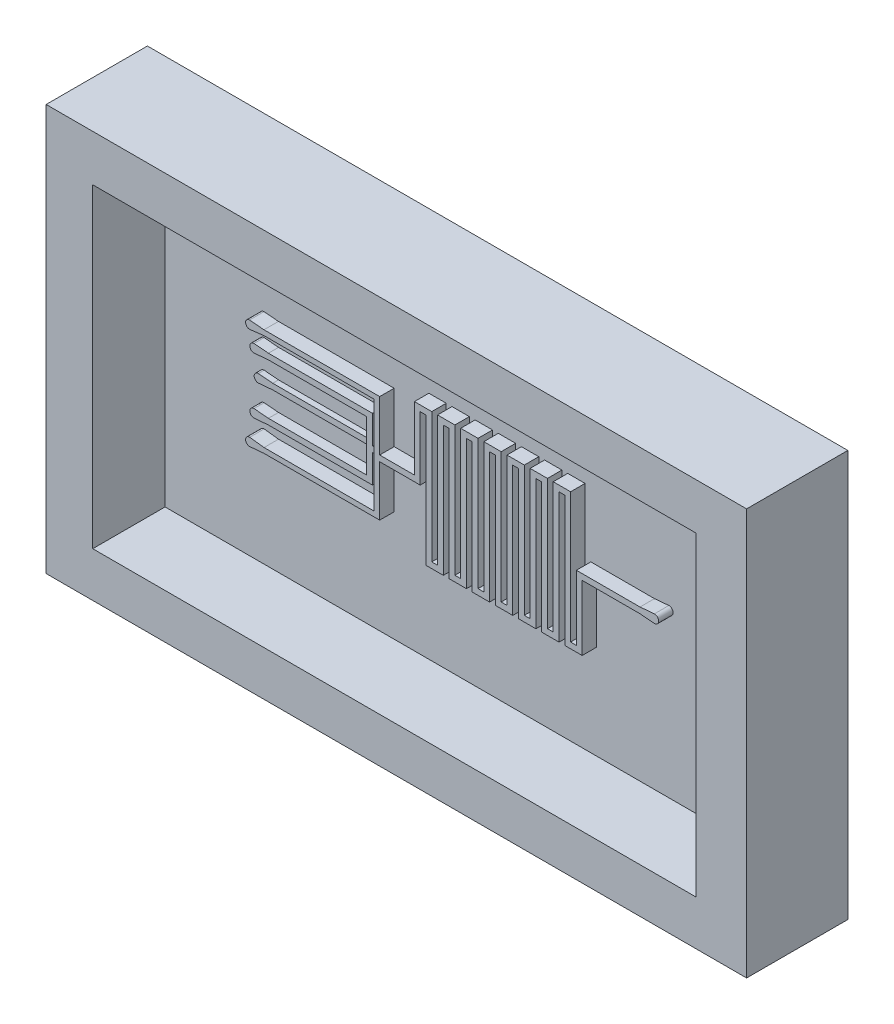
from build123d import *

# Parameters (mm, degrees)
BOSS_EXTRUDE1_DEPTH = 0.2
BOSS_EXTRUDE2_DEPTH = 0.35
BOSS_EXTRUDE3_DEPTH = 0.5
SKETCH2_W           = 20.858957108
SKETCH2_H           = 10.895771928
BOSS_EXTRUDE4_DEPTH = 1
SKETCH3_W           = 24.214928457
SKETCH3_H           = 14.045107393
SKETCH3_W_2         = 20.858957108
SKETCH3_H_2         = 10.895771928
BOSS_EXTRUDE5_DEPTH = 3.5


with BuildPart() as part:
    # Sketch1 → Boss-Extrude1 (new body)
    with BuildSketch(Plane.XY):
        with BuildLine():
            Line((-3.397107478, 0.09272626), (0.002892522, 0.09272626))
            Line((0.002892522, 0.09272626), (0.002892522, -0.10727374))
            Line((0.002892522, -0.10727374), (-3.397107478, -0.10727374))
            Line((-3.397107478, -0.10727374), (-3.895204827, -0.150851611))
            ThreePointArc((-3.895204827, -0.150851611), (-4.038782699, -0.00727374), (-3.895204827, 0.136304132))
            Line((-3.895204827, 0.136304132), (-3.397107478, 0.09272626))
        make_face()
    extrude(amount=BOSS_EXTRUDE1_DEPTH)

    # Sketch1<4> → Boss-Extrude2 (add)
    with BuildSketch(Plane.XY):
        with BuildLine():
            Line((0.402892522, -0.10727374), (0.402892522, 0.09272626))
            Line((0.402892522, 0.09272626), (0.202892522, 0.09272626))
            Line((0.202892522, 0.09272626), (0.202892522, 1.067220881))
            Line((0.202892522, 1.067220881), (-3.397107478, 1.067220881))
            Line((-3.397107478, 1.067220881), (-3.895204827, 1.110798752))
            ThreePointArc((-3.895204827, 1.110798752), (-4.038782699, 0.967220881), (-3.895204827, 0.82364301))
            Line((-3.895204827, 0.82364301), (-3.397107478, 0.867220881))
            Line((-3.397107478, 0.867220881), (0.002892522, 0.867220881))
            Line((0.002892522, 0.867220881), (0.002892522, 0.09272626))
            Line((0.002892522, 0.09272626), (0.002892522, -0.10727374))
            Line((0.002892522, -0.10727374), (0.002892522, -0.881768361))
            Line((0.002892522, -0.881768361), (-3.397107478, -0.881768361))
            Line((-3.397107478, -0.881768361), (-3.895204827, -0.838190489))
            ThreePointArc((-3.895204827, -0.838190489), (-4.038782699, -0.981768361), (-3.895204827, -1.125346232))
            Line((-3.895204827, -1.125346232), (-3.397107478, -1.081768361))
            Line((-3.397107478, -1.081768361), (0.202892522, -1.081768361))
            Line((0.202892522, -1.081768361), (0.202892522, -0.10727374))
            Line((0.202892522, -0.10727374), (0.402892522, -0.10727374))
        make_face()
    extrude(amount=BOSS_EXTRUDE2_DEPTH)

    # Sketch1<5> → Boss-Extrude3 (add)
    with BuildSketch(Plane.XY):
        with BuildLine():
            Line((1.8, 0.09272626), (0.6, 0.09272626))
            Line((0.6, 0.09272626), (0.6, 1.84272626))
            Line((0.6, 1.84272626), (-3.4, 1.84272626))
            Line((-3.4, 1.84272626), (-3.898097349, 1.886304132))
            ThreePointArc((-3.898097349, 1.886304132), (-4.035149554, 1.744700475), (-3.893545897, 1.607648271))
            Line((-3.893545897, 1.607648271), (-3.397107478, 1.667220881))
            Line((-3.397107478, 1.667220881), (0.402892522, 1.667220881))
            Line((0.402892522, 1.667220881), (0.402892522, -1.681768361))
            Line((0.402892522, -1.681768361), (-3.397107478, -1.681768361))
            Line((-3.397107478, -1.681768361), (-3.893545897, -1.62219575))
            ThreePointArc((-3.893545897, -1.62219575), (-4.035149554, -1.759247955), (-3.898097349, -1.900851611))
            Line((-3.898097349, -1.900851611), (-3.4, -1.85727374))
            Line((-3.4, -1.85727374), (0.6, -1.85727374))
            Line((0.6, -1.85727374), (0.6, -0.10727374))
            Line((0.6, -0.10727374), (2, -0.10727374))
            Line((2, -0.10727374), (2, 2.090619677))
            Line((2, 2.090619677), (2.2, 2.090619677))
            Line((2.2, 2.090619677), (2.2, -2.409380323))
            Line((2.2, -2.409380323), (2.8, -2.409380323))
            Line((2.8, -2.409380323), (2.8, 2.090619677))
            Line((2.8, 2.090619677), (3, 2.090619677))
            Line((3, 2.090619677), (3, -2.409380323))
            Line((3, -2.409380323), (3.6, -2.409380323))
            Line((3.6, -2.409380323), (3.6, 2.090619677))
            Line((3.6, 2.090619677), (3.8, 2.090619677))
            Line((3.8, 2.090619677), (3.8, -2.409380323))
            Line((3.8, -2.409380323), (4.4, -2.409380323))
            Line((4.4, -2.409380323), (4.4, 2.090619677))
            Line((4.4, 2.090619677), (4.6, 2.090619677))
            Line((4.6, 2.090619677), (4.6, -2.409380323))
            Line((4.6, -2.409380323), (5.2, -2.409380323))
            Line((5.2, -2.409380323), (5.2, 2.090619677))
            Line((5.2, 2.090619677), (5.4, 2.090619677))
            Line((5.4, 2.090619677), (5.4, -2.409380323))
            Line((5.4, -2.409380323), (6, -2.409380323))
            Line((6, -2.409380323), (6, 2.090619677))
            Line((6, 2.090619677), (6.2, 2.090619677))
            Line((6.2, 2.090619677), (6.2, -2.409380323))
            Line((6.2, -2.409380323), (6.8, -2.409380323))
            Line((6.8, -2.409380323), (6.8, 2.090619677))
            Line((6.8, 2.090619677), (7, 2.090619677))
            Line((7, 2.090619677), (7, -2.409380323))
            Line((7, -2.409380323), (7.6, -2.409380323))
            Line((7.6, -2.409380323), (7.6, -0.159380323))
            Line((7.6, -0.159380323), (9.6, -0.159380323))
            Line((9.6, -0.159380323), (10.098097349, -0.202958194))
            ThreePointArc((10.098097349, -0.202958194), (10.242728512, -0.058327031), (10.098097349, 0.086304132))
            Line((10.098097349, 0.086304132), (9.6, 0.04272626))
            Line((9.6, 0.04272626), (7.4, 0.04272626))
            Line((7.4, 0.04272626), (7.4, -2.20727374))
            Line((7.4, -2.20727374), (7.2, -2.20727374))
            Line((7.2, -2.20727374), (7.2, 2.29272626))
            Line((7.2, 2.29272626), (6.6, 2.29272626))
            Line((6.6, 2.29272626), (6.6, -2.20727374))
            Line((6.6, -2.20727374), (6.4, -2.20727374))
            Line((6.4, -2.20727374), (6.4, 2.29272626))
            Line((6.4, 2.29272626), (5.8, 2.29272626))
            Line((5.8, 2.29272626), (5.8, -2.20727374))
            Line((5.8, -2.20727374), (5.6, -2.20727374))
            Line((5.6, -2.20727374), (5.6, 2.29272626))
            Line((5.6, 2.29272626), (5, 2.29272626))
            Line((5, 2.29272626), (5, -2.20727374))
            Line((5, -2.20727374), (4.8, -2.20727374))
            Line((4.8, -2.20727374), (4.8, 2.29272626))
            Line((4.8, 2.29272626), (4.2, 2.29272626))
            Line((4.2, 2.29272626), (4.2, -2.20727374))
            Line((4.2, -2.20727374), (4, -2.20727374))
            Line((4, -2.20727374), (4, 2.29272626))
            Line((4, 2.29272626), (3.4, 2.29272626))
            Line((3.4, 2.29272626), (3.4, -2.20727374))
            Line((3.4, -2.20727374), (3.2, -2.20727374))
            Line((3.2, -2.20727374), (3.2, 2.29272626))
            Line((3.2, 2.29272626), (2.6, 2.29272626))
            Line((2.6, 2.29272626), (2.6, -2.20727374))
            Line((2.6, -2.20727374), (2.4, -2.20727374))
            Line((2.4, -2.20727374), (2.4, 2.29272626))
            Line((2.4, 2.29272626), (1.8, 2.29272626))
            Line((1.8, 2.29272626), (1.8, 0.09272626))
        make_face()
    extrude(amount=BOSS_EXTRUDE3_DEPTH)

    # Sketch2 → Boss-Extrude4 (add)
    with BuildSketch(Plane(origin=(0, 0, 0), x_dir=(-1, 0, 0), z_dir=(0, 0, -1))):
        with Locations((-3.109940625, -0.224118245)):
            Rectangle(SKETCH2_W, SKETCH2_H)
    extrude(amount=BOSS_EXTRUDE4_DEPTH)

    # Sketch3 → Boss-Extrude5 (add)
    with BuildSketch(Plane(origin=(0, 0, -1), x_dir=(-1, 0, 0), z_dir=(0, 0, -1))):
        with Locations((-3.177155759, -0.199662359)):
            Rectangle(SKETCH3_W, SKETCH3_H)
        with Locations((-3.109940625, -0.224118245)):
            Rectangle(SKETCH3_W_2, SKETCH3_H_2, mode=Mode.SUBTRACT)
    extrude(amount=-BOSS_EXTRUDE5_DEPTH)


solid = part.part
